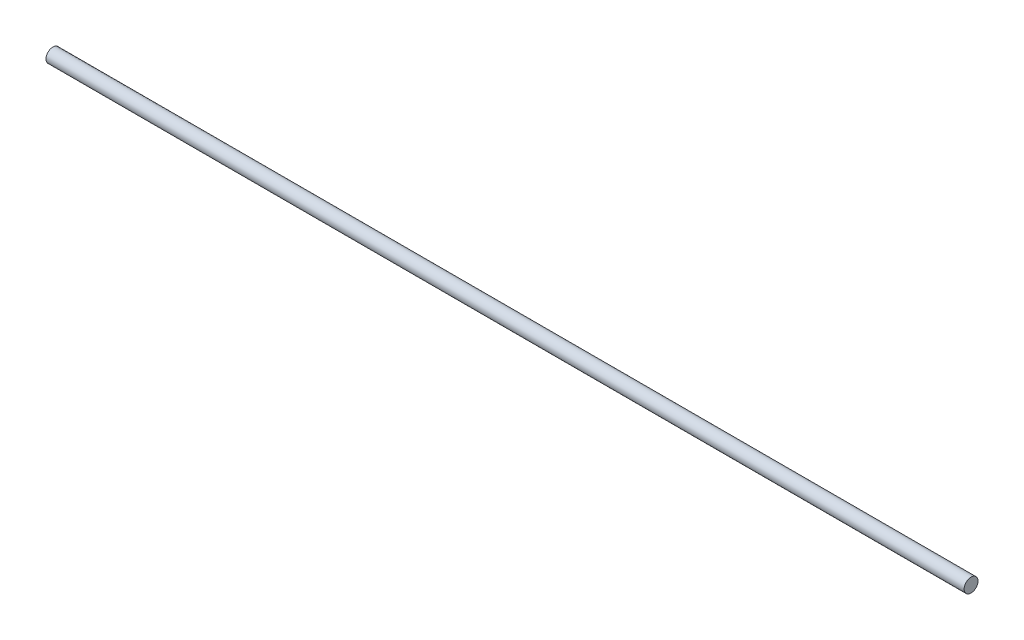
from build123d import *

# Parameters (mm, degrees)
SKETCH1_R           = 4
BOSS_EXTRUDE1_DEPTH = 530


with BuildPart() as part:
    # Sketch1 → Boss-Extrude1 (new body)
    with BuildSketch(Plane(origin=(0, 0, 0), x_dir=(0, 0, -1), z_dir=(1, 0, 0))):
        Circle(SKETCH1_R)
    extrude(amount=BOSS_EXTRUDE1_DEPTH)


solid = part.part
